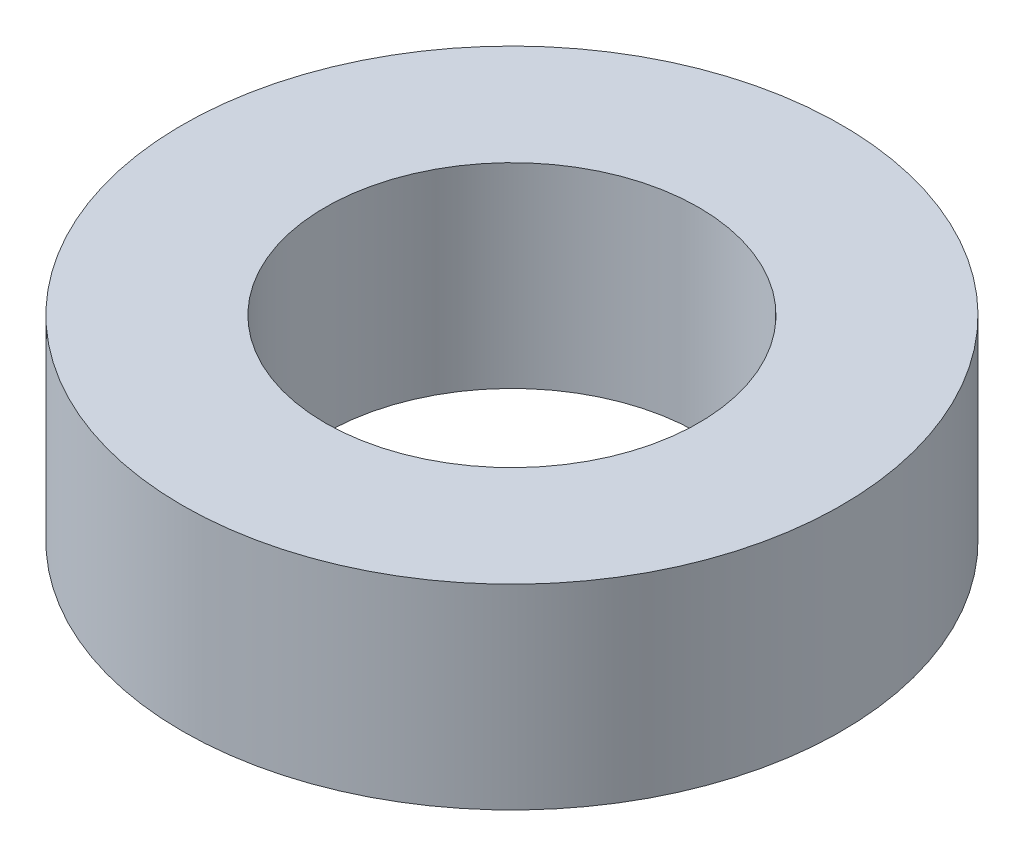
from build123d import *

# Parameters (mm, degrees)
SKETCH_2_R      = 15
SKETCH_2_R_2    = 8.5
EXTRUDE_1_DEPTH = 8.9


with BuildPart() as part:
    # Эскиз2 → Вытянуть1 (new body)
    with BuildSketch(Plane(origin=(0, 0, 0), x_dir=(1, 0, 0), z_dir=(0, 1, 0))):
        with Locations(Location((0, 0, 0), (0, 0, 270))):
            Circle(SKETCH_2_R)
        with Locations(Location((0, 0, 0), (0, 0, 270))):
            Circle(SKETCH_2_R_2, mode=Mode.SUBTRACT)
    extrude(amount=EXTRUDE_1_DEPTH)


solid = part.part
